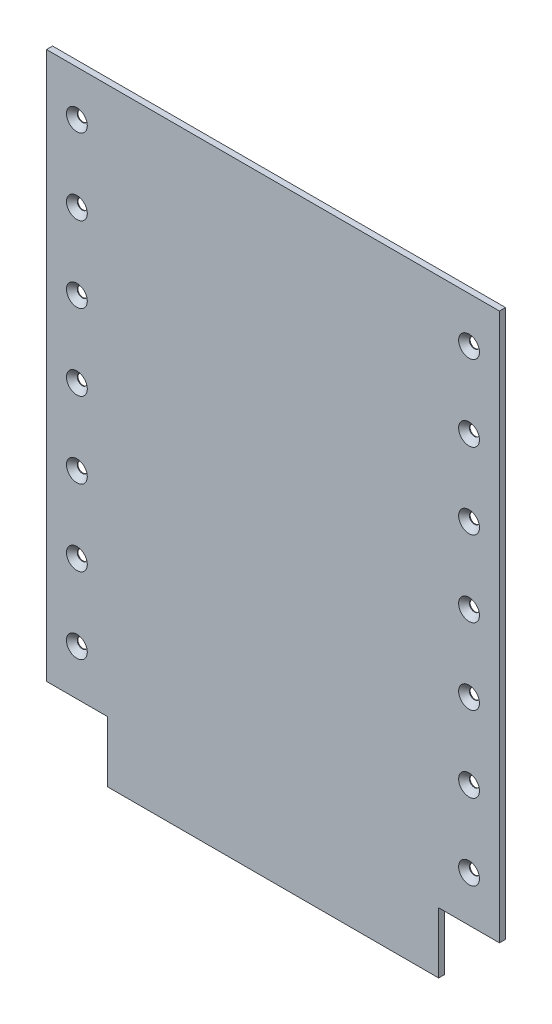
from build123d import *

# Parameters (mm, degrees)
EXTRUDE_1_DEPTH             = 4
HOLE_WIZARD_M61_AT_2_COUNT  = 2
HOLE_WIZARD_M61_AT_2_PITCH  = 258
HOLE_WIZARD_M61_AT_3_COUNT  = 2
HOLE_WIZARD_M61_AT_3_PITCH  = 50
HOLE_WIZARD_M61_AT_4_COUNT  = 2
HOLE_WIZARD_M61_AT_4_PITCH  = 262.800304414
HOLE_WIZARD_M61_AT_5_COUNT  = 2
HOLE_WIZARD_M61_AT_5_PITCH  = 100
HOLE_WIZARD_M61_AT_6_COUNT  = 2
HOLE_WIZARD_M61_AT_6_PITCH  = 276.702005775
HOLE_WIZARD_M61_AT_7_COUNT  = 2
HOLE_WIZARD_M61_AT_7_PITCH  = 150
HOLE_WIZARD_M61_AT_8_COUNT  = 2
HOLE_WIZARD_M61_AT_8_PITCH  = 298.435922771
HOLE_WIZARD_M61_AT_9_COUNT  = 2
HOLE_WIZARD_M61_AT_9_PITCH  = 200
HOLE_WIZARD_M61_AT_10_COUNT = 2
HOLE_WIZARD_M61_AT_10_PITCH = 326.441418941
HOLE_WIZARD_M61_AT_11_COUNT = 2
HOLE_WIZARD_M61_AT_11_PITCH = 250
HOLE_WIZARD_M61_AT_12_COUNT = 2
HOLE_WIZARD_M61_AT_12_PITCH = 359.254784241
HOLE_WIZARD_M61_AT_13_COUNT = 2
HOLE_WIZARD_M61_AT_13_PITCH = 300
HOLE_WIZARD_M61_AT_14_COUNT = 2
HOLE_WIZARD_M61_AT_14_PITCH = 395.681690251


with BuildPart() as part:
    # Эскиз1 → Бобышка-Вытянуть1 (new body)
    with BuildSketch(Plane.XY):
        Polygon((0, 400), (-40, 400), (-40, 40), (0, 40), (0, 0), (218, 0), (218, 40), (258, 40), (258, 400), (218, 400), align=None)
    extrude(amount=EXTRUDE_1_DEPTH)

    # Эскиз2 → Зенковка для винта с потайной головкой и внутренним шестигранником M61 (revolve, cut)
    with BuildSketch(Plane(origin=(238, 70, 4), x_dir=(0, -1, 0), z_dir=(1, 0, 0))):
        Polygon((0, 0), (0, 4), (3.3, 4), (3.3, 3.555), (6.855, 0), align=None)
    hole_wizard_m61 = revolve(axis=Axis((238, 70, 10.35), (0, 0, -1)), mode=Mode.SUBTRACT)

    # Зенковка для винта с потайной головкой и внутренним шестигранником M61 at 2: Зенковка для винта с потайной головкой и внутренним шестигранником M61 ×2
    with Locations(*[(-i * HOLE_WIZARD_M61_AT_2_PITCH, 0, 0) for i in range(1, HOLE_WIZARD_M61_AT_2_COUNT)]):
        add(hole_wizard_m61, mode=Mode.SUBTRACT)

    # Зенковка для винта с потайной головкой и внутренним шестигранником M61 at 3: Зенковка для винта с потайной головкой и внутренним шестигранником M61 ×2
    with Locations(*[(0, i * HOLE_WIZARD_M61_AT_3_PITCH, 0) for i in range(1, HOLE_WIZARD_M61_AT_3_COUNT)]):
        add(hole_wizard_m61, mode=Mode.SUBTRACT)

    # Зенковка для винта с потайной головкой и внутренним шестигранником M61 at 4: Зенковка для винта с потайной головкой и внутренним шестигранником M61 ×2
    with Locations(*[Vector(-0.9817340226278134, 0.19025853151701805, 0) * (i * HOLE_WIZARD_M61_AT_4_PITCH) for i in range(1, HOLE_WIZARD_M61_AT_4_COUNT)]):
        add(hole_wizard_m61, mode=Mode.SUBTRACT)

    # Зенковка для винта с потайной головкой и внутренним шестигранником M61 at 5: Зенковка для винта с потайной головкой и внутренним шестигранником M61 ×2
    with Locations(*[(0, i * HOLE_WIZARD_M61_AT_5_PITCH, 0) for i in range(1, HOLE_WIZARD_M61_AT_5_COUNT)]):
        add(hole_wizard_m61, mode=Mode.SUBTRACT)

    # Зенковка для винта с потайной головкой и внутренним шестигранником M61 at 6: Зенковка для винта с потайной головкой и внутренним шестигранником M61 ×2
    with Locations(*[Vector(-0.9324110220206997, 0.36139962093825506, 0) * (i * HOLE_WIZARD_M61_AT_6_PITCH) for i in range(1, HOLE_WIZARD_M61_AT_6_COUNT)]):
        add(hole_wizard_m61, mode=Mode.SUBTRACT)

    # Зенковка для винта с потайной головкой и внутренним шестигранником M61 at 7: Зенковка для винта с потайной головкой и внутренним шестигранником M61 ×2
    with Locations(*[(0, i * HOLE_WIZARD_M61_AT_7_PITCH, 0) for i in range(1, HOLE_WIZARD_M61_AT_7_COUNT)]):
        add(hole_wizard_m61, mode=Mode.SUBTRACT)

    # Зенковка для винта с потайной головкой и внутренним шестигранником M61 at 8: Зенковка для винта с потайной головкой и внутренним шестигранником M61 ×2
    with Locations(*[Vector(-0.8645071866841932, 0.5026204573745298, 0) * (i * HOLE_WIZARD_M61_AT_8_PITCH) for i in range(1, HOLE_WIZARD_M61_AT_8_COUNT)]):
        add(hole_wizard_m61, mode=Mode.SUBTRACT)

    # Зенковка для винта с потайной головкой и внутренним шестигранником M61 at 9: Зенковка для винта с потайной головкой и внутренним шестигранником M61 ×2
    with Locations(*[(0, i * HOLE_WIZARD_M61_AT_9_PITCH, 0) for i in range(1, HOLE_WIZARD_M61_AT_9_COUNT)]):
        add(hole_wizard_m61, mode=Mode.SUBTRACT)

    # Зенковка для винта с потайной головкой и внутренним шестигранником M61 at 10: Зенковка для винта с потайной головкой и внутренним шестигранником M61 ×2
    with Locations(*[Vector(-0.7903408851647249, 0.61266735284087, 0) * (i * HOLE_WIZARD_M61_AT_10_PITCH) for i in range(1, HOLE_WIZARD_M61_AT_10_COUNT)]):
        add(hole_wizard_m61, mode=Mode.SUBTRACT)

    # Зенковка для винта с потайной головкой и внутренним шестигранником M61 at 11: Зенковка для винта с потайной головкой и внутренним шестигранником M61 ×2
    with Locations(*[(0, i * HOLE_WIZARD_M61_AT_11_PITCH, 0) for i in range(1, HOLE_WIZARD_M61_AT_11_COUNT)]):
        add(hole_wizard_m61, mode=Mode.SUBTRACT)

    # Зенковка для винта с потайной головкой и внутренним шестигранником M61 at 12: Зенковка для винта с потайной головкой и внутренним шестигранником M61 ×2
    with Locations(*[Vector(-0.7181532753840043, 0.6958849567674433, 0) * (i * HOLE_WIZARD_M61_AT_12_PITCH) for i in range(1, HOLE_WIZARD_M61_AT_12_COUNT)]):
        add(hole_wizard_m61, mode=Mode.SUBTRACT)

    # Зенковка для винта с потайной головкой и внутренним шестигранником M61 at 13: Зенковка для винта с потайной головкой и внутренним шестигранником M61 ×2
    with Locations(*[(0, i * HOLE_WIZARD_M61_AT_13_PITCH, 0) for i in range(1, HOLE_WIZARD_M61_AT_13_COUNT)]):
        add(hole_wizard_m61, mode=Mode.SUBTRACT)

    # Зенковка для винта с потайной головкой и внутренним шестигранником M61 at 14: Зенковка для винта с потайной головкой и внутренним шестигранником M61 ×2
    with Locations(*[Vector(-0.6520392688280492, 0.7581851963116815, 0) * (i * HOLE_WIZARD_M61_AT_14_PITCH) for i in range(1, HOLE_WIZARD_M61_AT_14_COUNT)]):
        add(hole_wizard_m61, mode=Mode.SUBTRACT)


solid = part.part
